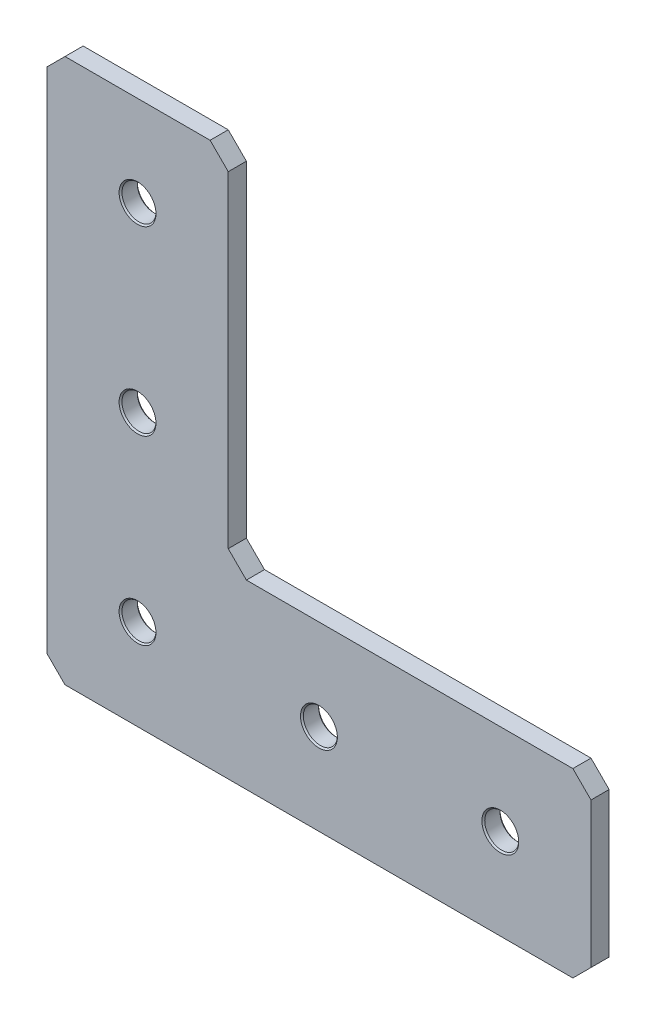
from build123d import *

# Parameters (mm, degrees)
BOSS_EXTRUDE1_DEPTH            = 2.54
F_3_16_0_1875_DIAMETER_HOLE1_D = 4.7625
CHAMFER1_SIZE                  = 2.54
CHAMFER2_SIZE                  = 0.2


with BuildPart() as part:
    # Sketch1 → Boss-Extrude1 (new body)
    with BuildSketch(Plane.XY):
        Polygon((0, 0), (0, 50.8), (-25.4, 50.8), (-25.4, 0), (-25.4, -25.4), (50.8, -25.4), (50.8, 0), align=None)
    extrude(amount=BOSS_EXTRUDE1_DEPTH)

    # 3/16 (0.1875) Diameter Hole1 (through all)
    with Locations(Plane.XY.offset(2.54)):
        with Locations((-12.7, 38.1), (-12.7, 12.7), (-12.7, -12.7), (12.7, -12.7), (38.1, -12.7)):
            Hole(F_3_16_0_1875_DIAMETER_HOLE1_D / 2)

    # Chamfer1
    chamfer1_edges = [part.edges().sort_by_distance(p)[0] for p in [
        (50.8, 0, 1.27),
        (50.8, -25.4, 1.27),
        (-25.4, -25.4, 1.27),
        (-25.4, 50.8, 1.27),
        (0, 50.8, 1.27),
        (0, 0, 1.27),
    ]]
    chamfer(chamfer1_edges, length=CHAMFER1_SIZE)

    # Chamfer2
    chamfer2_edges = [part.edges().sort_by_distance(p)[0] for p in [
        (40.48125, -12.7, 2.54),
        (40.48125, -12.7, 0),
        (15.08125, -12.7, 2.54),
        (15.08125, -12.7, 0),
        (-10.31875, -12.7, 2.54),
        (-10.31875, -12.7, 0),
        (-10.31875, 12.7, 2.54),
        (-10.31875, 12.7, 0),
        (-10.31875, 38.1, 2.54),
        (-10.31875, 38.1, 0),
    ]]
    chamfer(chamfer2_edges, length=CHAMFER2_SIZE)


solid = part.part
